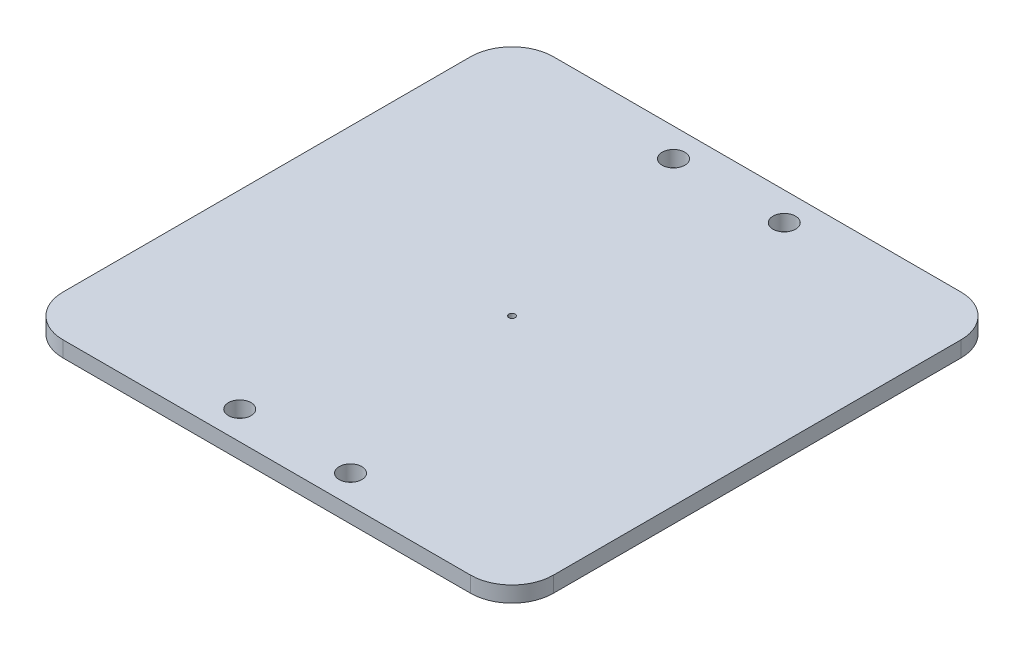
from build123d import *

# Parameters (mm, degrees)
SKETCH1_W           = 45.085
SKETCH1_H           = 45.085
BOSS_EXTRUDE1_DEPTH = 1.4478
SKETCH2_R           = 0.290766207
SKETCH2_R_2         = 1.0414
CUT_EXTRUDE1_DEPTH  = 3.54
FILLET1_R           = 3.81


with BuildPart() as part:
    # Sketch1 → Boss-Extrude1 (new body)
    with BuildSketch(Plane(origin=(0, 0, 0), x_dir=(1, 0, 0), z_dir=(0, 1, 0))):
        Rectangle(SKETCH1_W, SKETCH1_H)
    extrude(amount=BOSS_EXTRUDE1_DEPTH)

    # Sketch2 → Cut-Extrude1 (cut)
    with BuildSketch(Plane(origin=(0, 1.4478, 0), x_dir=(1, 0, 0), z_dir=(0, 1, 0))):
        with Locations(Location((0, 0, 0), (0, 0, 270))):
            Circle(SKETCH2_R)
        with Locations(Location((-5.0927, 19.939, 0), (0, 0, 270))):
            Circle(SKETCH2_R_2)
        with Locations(Location((5.0927, 19.939, 0), (0, 0, 270))):
            Circle(SKETCH2_R_2)
        with Locations(Location((5.0927, -19.939, 0), (0, 0, 270))):
            Circle(SKETCH2_R_2)
        with Locations(Location((-5.0927, -19.939, 0), (0, 0, 270))):
            Circle(SKETCH2_R_2)
    extrude(amount=-CUT_EXTRUDE1_DEPTH, mode=Mode.SUBTRACT)

    # Fillet1
    fillet1_edges = [part.edges().sort_by_distance(p)[0] for p in [
        (22.5425, 0.7239, 22.5425),
        (-22.5425, 0.7239, 22.5425),
        (-22.5425, 0.7239, -22.5425),
        (22.5425, 0.7239, -22.5425),
    ]]
    fillet(fillet1_edges, radius=FILLET1_R)


solid = part.part
